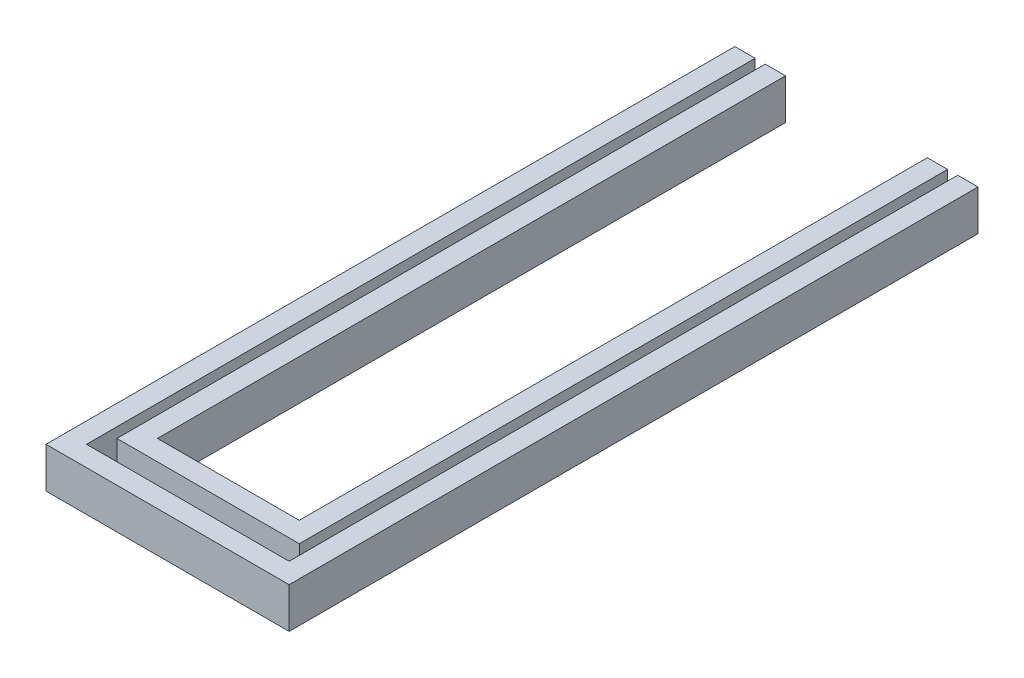
from build123d import *

# Parameters (mm, degrees)
BOSS_EXTRUDE1_DEPTH   = 50.8
BOSS_EXTRUDE1_2_DEPTH = 50.8


with BuildPart() as part:
    # Sketch1 → Boss-Extrude1 (new body)
    with BuildSketch(Plane(origin=(0, 0, 0), x_dir=(1, 0, 0), z_dir=(0, 1, 0))):
        Polygon((0, 863.6), (0, 0), (304.8, 0), (304.8, 863.6), (279.4, 863.6), (279.4, 25.4), (25.4, 25.4), (25.4, 863.6), align=None)
    extrude(amount=BOSS_EXTRUDE1_DEPTH)


with BuildPart() as body_2:
    # Sketch1 → Boss-Extrude1 2 (new body)
    with BuildSketch(Plane(origin=(0, 0, 0), x_dir=(1, 0, 0), z_dir=(0, 1, 0))):
        Polygon((63.5, 863.6), (38.1, 863.6), (38.1, 50.8), (266.7, 50.8), (266.7, 863.6), (241.3, 863.6), (241.3, 76.2), (63.5, 76.2), align=None)
    extrude(amount=BOSS_EXTRUDE1_2_DEPTH)


solid = Compound([part.part, body_2.part])
